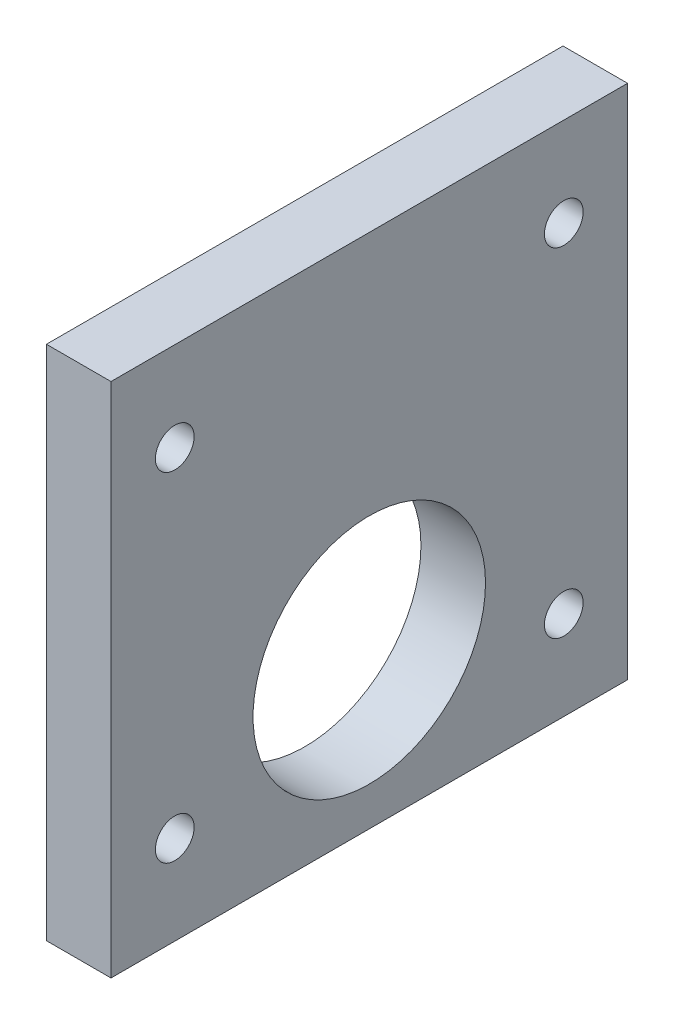
from build123d import *

# Parameters (mm, degrees)
SKETCH1_W           = 40
SKETCH1_H           = 40
SKETCH1_R           = 9
SKETCH1_R_2         = 1.5
BOSS_EXTRUDE1_DEPTH = 5


with BuildPart() as part:
    # Sketch1 → Boss-Extrude1 (new body)
    with BuildSketch(Plane(origin=(0, 0, 0), x_dir=(0, 0, -1), z_dir=(1, 0, 0))):
        with Locations((33.747195152, -20)):
            Rectangle(SKETCH1_W, SKETCH1_H)
        with Locations((33.747195152, -28)):
            Circle(SKETCH1_R, mode=Mode.SUBTRACT)
        with Locations((18.685090131, -6.89933539)):
            Circle(SKETCH1_R_2, mode=Mode.SUBTRACT)
        with Locations(Location((18.685090131, -33.10066461, 0), (0, 0, 180))):
            Circle(SKETCH1_R_2, mode=Mode.SUBTRACT)
        with Locations((48.809300173, -33.10066461)):
            Circle(SKETCH1_R_2, mode=Mode.SUBTRACT)
        with Locations(Location((48.809300173, -6.89933539, 0), (0, 0, 180))):
            Circle(SKETCH1_R_2, mode=Mode.SUBTRACT)
    extrude(amount=BOSS_EXTRUDE1_DEPTH)


solid = part.part
